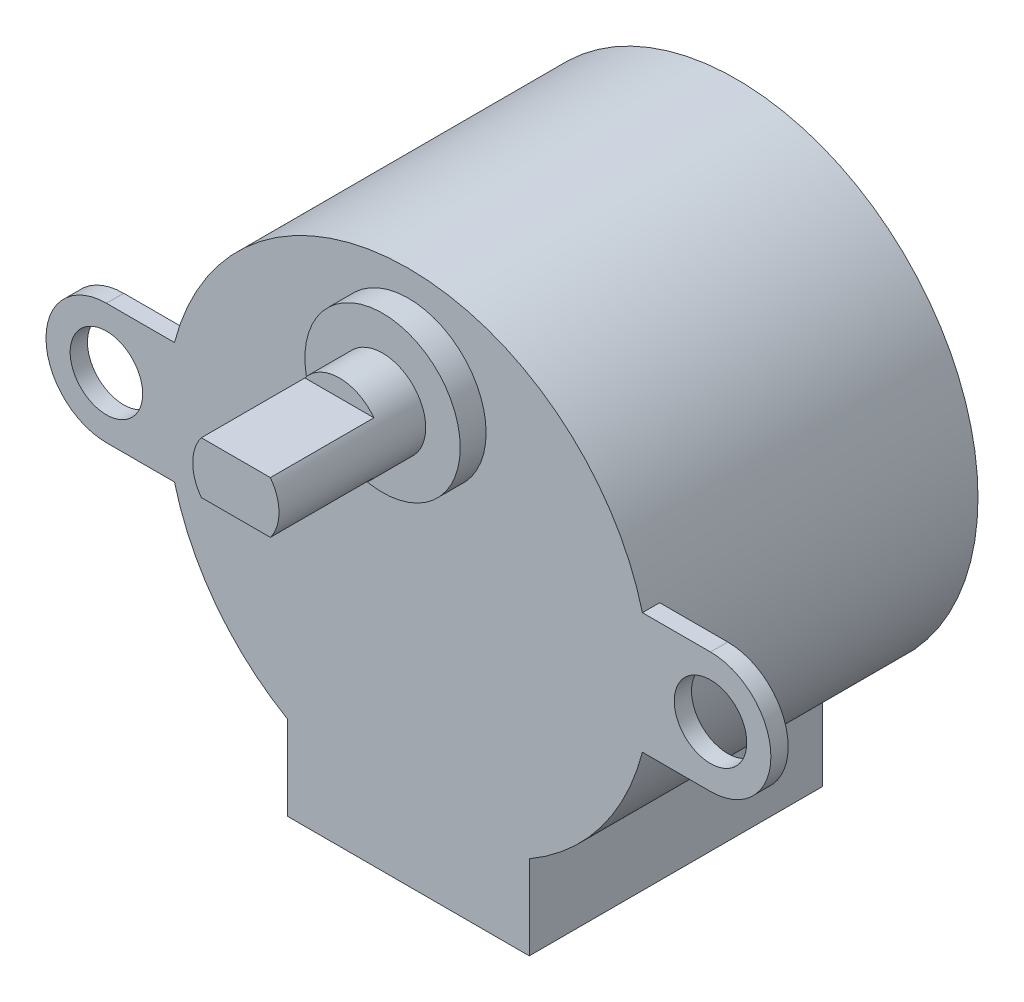
from build123d import *
from build123d.topology import SkipClean

# Parameters (mm, degrees)
SKETCH2_R           = 14
BOSS_EXTRUDE1_DEPTH = 19
SKETCH3_R           = 2.5
BOSS_EXTRUDE2_DEPTH = 4
SKETCH3_3_R         = 4.5
BOSS_EXTRUDE3_DEPTH = 1.5
BOSS_EXTRUDE4_DEPTH = 6
SKETCH6_W           = 14
SKETCH6_H           = 17
BOSS_EXTRUDE5_DEPTH = 17
SKETCH7_R           = 2.1
BOSS_EXTRUDE6_DEPTH = 1


with BuildPart() as part:
    # Sketch2 → Boss-Extrude1 (new body)
    with BuildSketch(Plane.XY):
        Circle(SKETCH2_R)
    extrude(amount=BOSS_EXTRUDE1_DEPTH)

    # Sketch3 → Boss-Extrude2 (add)
    with BuildSketch(Plane.XY.offset(19)):
        with Locations((0, 8)):
            Circle(SKETCH3_R)
    extrude(amount=BOSS_EXTRUDE2_DEPTH)

    # Sketch3<3> → Boss-Extrude3 (add)
    with BuildSketch(Plane.XY.offset(19)):
        with Locations((0, 8)):
            Circle(SKETCH3_3_R)
    extrude(amount=BOSS_EXTRUDE3_DEPTH)

    # Sketch4 → Boss-Extrude4 (add)
    with SkipClean():  # the faces are left unmerged after this step: merging them gives an invalid solid
        with BuildSketch(Plane.XY.offset(23)):
            with BuildLine():
                Line((-2, 9.5), (2, 9.5))
                ThreePointArc((2, 9.5), (2.5, 8), (2, 6.5))
                Line((2, 6.5), (-2, 6.5))
                ThreePointArc((-2, 6.5), (-2.5, 8), (-2, 9.5))
            make_face()
        extrude(amount=BOSS_EXTRUDE4_DEPTH)

    # Sketch6 → Boss-Extrude5 (add)
    with SkipClean():  # the faces are left unmerged after this step: merging them gives an invalid solid
        with BuildSketch(Plane.XY.offset(19)):
            with Locations((0, -8.5)):
                Rectangle(SKETCH6_W, SKETCH6_H)
        extrude(amount=-BOSS_EXTRUDE5_DEPTH)

    # Sketch7 → Boss-Extrude6 (add)
    with SkipClean():  # the faces are left unmerged after this step: merging them gives an invalid solid
        with BuildSketch(Plane.XY.offset(19)):
            with BuildLine():
                Line((-17.5, 3.5), (17.5, 3.5))
                ThreePointArc((17.5, 3.5), (21, 0), (17.5, -3.5))
                Line((17.5, -3.5), (-17.5, -3.5))
                ThreePointArc((-17.5, -3.5), (-21, 0), (-17.5, 3.5))
            make_face()
            with Locations((-17.5, 0)):
                Circle(SKETCH7_R, mode=Mode.SUBTRACT)
            with Locations((17.5, 0)):
                Circle(SKETCH7_R, mode=Mode.SUBTRACT)
        extrude(amount=-BOSS_EXTRUDE6_DEPTH)


solid = part.part
